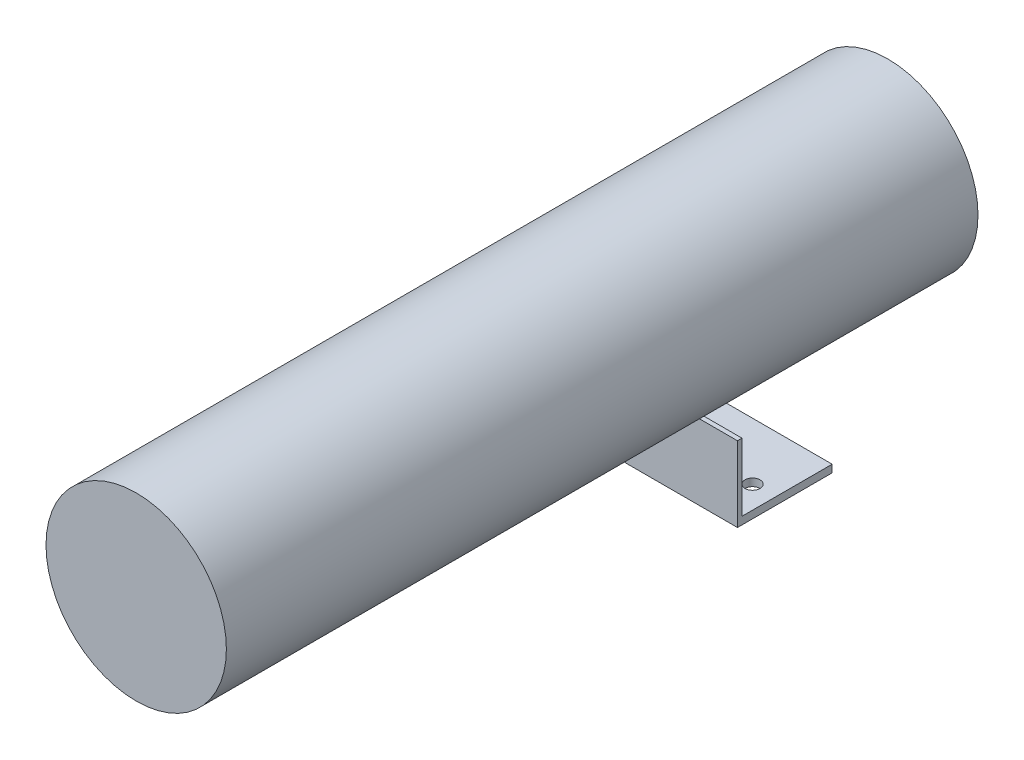
from build123d import *

# Parameters (mm, degrees)
SKETCH1_R           = 76.2
BOSS_EXTRUDE2_DEPTH = 635
SKETCH8_R           = 12.7
BOSS_EXTRUDE3_DEPTH = 12.7
SKETCH9_R           = 7.62
BOSS_EXTRUDE4_DEPTH = 5.08
BOSS_EXTRUDE5_DEPTH = 7.62
BOSS_EXTRUDE6_DEPTH = 2.54
SKETCH12_R          = 5.08
BOSS_EXTRUDE7_DEPTH = 5.08
SKETCH14_W          = 127
SKETCH14_H          = 63.5
BOSS_EXTRUDE8_DEPTH = 3.81
SKETCH15_W          = 127
SKETCH15_H          = 6.35
BOSS_EXTRUDE9_DEPTH = 76.2
SKETCH16_R          = 6.35
CUT_EXTRUDE1_DEPTH  = 674.010135511


with BuildPart() as part:
    # Sketch1 → Boss-Extrude2 (new body)
    with BuildSketch(Plane.XY):
        with Locations(Location((0, 0, 0), (0, 0, 180))):
            Circle(SKETCH1_R)
    extrude(amount=BOSS_EXTRUDE2_DEPTH)


with BuildPart() as body_2:
    # Sketch8 → Boss-Extrude3 (new body)
    with BuildSketch(Plane(origin=(0, 0, 0), x_dir=(-1, 0, 0), z_dir=(0, 0, -1))):
        Circle(SKETCH8_R)
    extrude(amount=BOSS_EXTRUDE3_DEPTH)

    # Sketch9 → Boss-Extrude4 (add)
    with BuildSketch(Plane(origin=(0, 0, -12.7), x_dir=(1, 0, 0), z_dir=(0, 0, -1))):
        with Locations(Location((0, 0, 0), (0, 0, 270))):
            Circle(SKETCH9_R)
    extrude(amount=BOSS_EXTRUDE4_DEPTH)

    # Sketch10 → Boss-Extrude5 (add)
    with BuildSketch(Plane(origin=(0, 0, -17.78), x_dir=(1, 0, 0), z_dir=(0, 0, -1))):
        Polygon((0.10018358, 13.020093655), (-11.225640075, 6.596808353), (-11.325823655, -6.423285302), (-0.10018358, -13.020093655), (11.225640075, -6.596808353), (11.325823655, 6.423285302), align=None)
    extrude(amount=BOSS_EXTRUDE5_DEPTH)

    # Sketch11 → Boss-Extrude6 (add)
    with BuildSketch(Plane(origin=(0, 0, -25.4), x_dir=(1, 0, 0), z_dir=(0, 0, -1))):
        Polygon((-7.408868452, 4.353861781), (-7.474989133, -4.239337402), (-0.066120681, -8.593199183), (7.408868452, -4.353861781), (7.474989133, 4.239337402), (0.066120681, 8.593199183), align=None)
    extrude(amount=BOSS_EXTRUDE6_DEPTH)

    # Sketch12 → Boss-Extrude7 (add)
    with BuildSketch(Plane(origin=(0, 0, -27.94), x_dir=(1, 0, 0), z_dir=(0, 0, -1))):
        with Locations(Location((0, 0, 0), (0, 0, 270))):
            Circle(SKETCH12_R)
    extrude(amount=BOSS_EXTRUDE7_DEPTH)


with BuildPart() as body_3:
    # Sketch14 → Boss-Extrude8 (new body)
    with BuildSketch(Plane(origin=(0, 0, 190.5), x_dir=(-1, 0, 0), z_dir=(0, 0, -1))):
        with Locations((0, -107.95)):
            Rectangle(SKETCH14_W, SKETCH14_H)
    extrude(amount=BOSS_EXTRUDE8_DEPTH)

    # Sketch15 → Boss-Extrude9 (add)
    with BuildSketch(Plane(origin=(0, 0, 186.69), x_dir=(-1, 0, 0), z_dir=(0, 0, -1))):
        with Locations((0, -136.525)):
            Rectangle(SKETCH15_W, SKETCH15_H)
    extrude(amount=BOSS_EXTRUDE9_DEPTH)

    # Sketch16 → Cut-Extrude1 (cut, through all)
    with BuildSketch(Plane(origin=(0, -133.35, 0), x_dir=(1, 0, 0), z_dir=(0, 1, 0))):
        with Locations(Location((44.45, -158.75, 0), (0, 0, 270))):
            Circle(SKETCH16_R)
        with Locations(Location((-44.45, -158.75, 0), (0, 0, 270))):
            Circle(SKETCH16_R)
    extrude(amount=-CUT_EXTRUDE1_DEPTH, mode=Mode.SUBTRACT)


solid = Compound([part.part, body_2.part, body_3.part])
